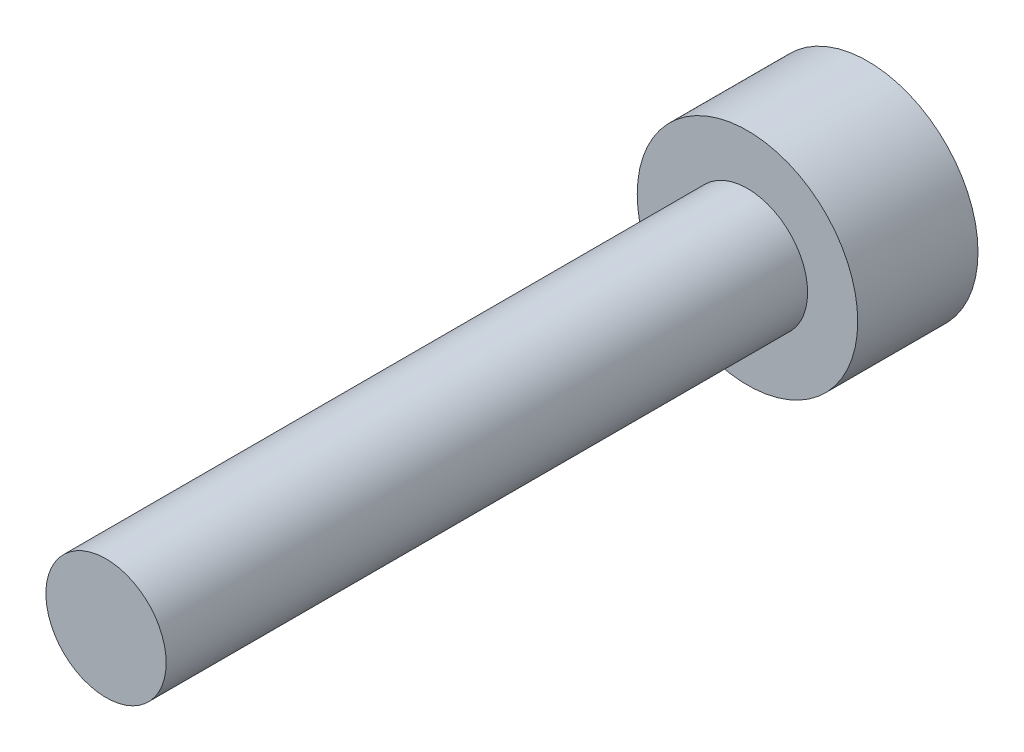
from build123d import *

# Parameters (mm, degrees)
SKETCH_1_R            = 1.5
EXTRUDE_M3_DEPTH      = 16
SKETCH_2_R            = 2.75
EXTRUDE_248_DEPTH     = 3
CUT_EXTRUDE_327_DEPTH = 1.3


with BuildPart() as part:
    # 草图1 → M3螺杆_螺纹简化 (new body)
    with BuildSketch(Plane.XY):
        Circle(SKETCH_1_R)
    extrude(amount=EXTRUDE_M3_DEPTH)

    # 草图2 → Extrude 248 (add)
    with BuildSketch(Plane.XY):
        Circle(SKETCH_2_R)
    extrude(amount=-EXTRUDE_248_DEPTH)

    # 草图3 → Cut-Extrude 327 (cut)
    with BuildSketch(Plane(origin=(0, 0, -3), x_dir=(-1, 0, 0), z_dir=(0, 0, -1))):
        Polygon((1.443375673, 0), (0.721687836, 1.25), (-0.721687836, 1.25), (-1.443375673, 0), (-0.721687836, -1.25), (0.721687836, -1.25), align=None)
    extrude(amount=-CUT_EXTRUDE_327_DEPTH, mode=Mode.SUBTRACT)


solid = part.part
